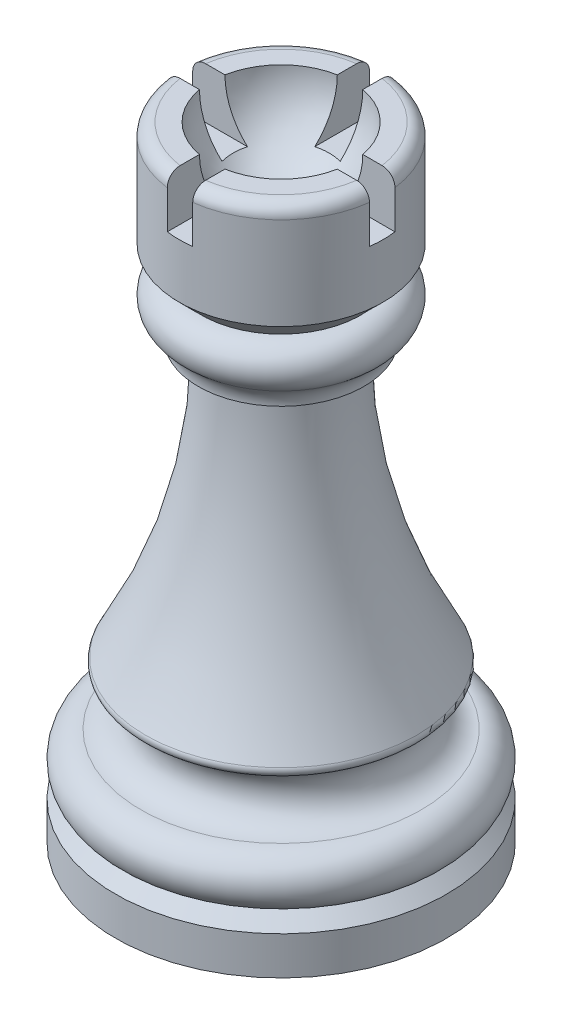
from build123d import *

# Parameters (mm, degrees)
FILLET1_R               = 0.5
CUT_EXTRUDE1_DEPTH      = 10
CUT_EXTRUDE1_DEPTH_BACK = 10
SKETCH2_W               = 2
SKETCH2_H               = 4
CUT_EXTRUDE2_DEPTH      = 10
CUT_EXTRUDE2_DEPTH_BACK = 10
SKETCH3_W               = 2
SKETCH3_H               = 4


with BuildPart() as part:
    # Sketch1 → Revolve2 (revolve)
    with BuildSketch(Plane(origin=(0, 0, 0), x_dir=(0, 0, -1), z_dir=(1, 0, 0))):
        with BuildLine():
            Line((0, 0), (0, 43.5))
            ThreePointArc((0, 43.5), (3.889087297, 45.110912703), (5.5, 49))
            Line((5.5, 49), (7, 49))
            ThreePointArc((7, 49), (7.707106781, 48.707106781), (8, 48))
            Line((8, 48), (8, 40.740342281))
            Line((8, 40.740342281), (6.259657719, 39))
            ThreePointArc((6.259657719, 39), (7.911046112, 37.808936912), (7.302065633, 35.866037615))
            ThreePointArc((7.302065633, 35.866037615), (6.711723073, 35.160071642), (6.5, 34.264490471))
            Line((6.5, 34.264490471), (5, 34))
            ThreePointArc((5, 34), (6.52690108, 22.598245749), (11, 12))
            ThreePointArc((11, 12), (8.866025404, 9.866025404), (11, 7.732050808))
            ThreePointArc((11, 7.732050808), (12.931851653, 6.249688898), (12, 4))
            Line((12, 4), (13, 3))
            Line((13, 3), (13, 0))
            Line((13, 0), (0, 0))
        make_face()
    revolve(axis=Axis((0, 0, 0), (0, 1, 0)))

    # Fillet1
    fillet1_edges = [part.edges().sort_by_distance(p)[0] for p in [
        (0, 12, 11),
    ]]
    fillet(fillet1_edges, radius=FILLET1_R)

    # Sketch2 → Cut-Extrude1 (cut, two sides: drawn at the far end of the back side and taken through both)
    with BuildSketch(Plane(origin=(0, 0, 0), x_dir=(0, 0, -1), z_dir=(1, 0, 0)).offset(-CUT_EXTRUDE1_DEPTH_BACK)):
        with Locations((0, 47)):
            Rectangle(SKETCH2_W, SKETCH2_H)
    extrude(amount=CUT_EXTRUDE1_DEPTH + CUT_EXTRUDE1_DEPTH_BACK, mode=Mode.SUBTRACT)

    # Sketch3 → Cut-Extrude2 (cut, two sides: drawn at the far end of the back side and taken through both)
    with BuildSketch(Plane.XY.offset(-CUT_EXTRUDE2_DEPTH_BACK)):
        with Locations((0, 47)):
            Rectangle(SKETCH3_W, SKETCH3_H)
    extrude(amount=CUT_EXTRUDE2_DEPTH + CUT_EXTRUDE2_DEPTH_BACK, mode=Mode.SUBTRACT)


solid = part.part
